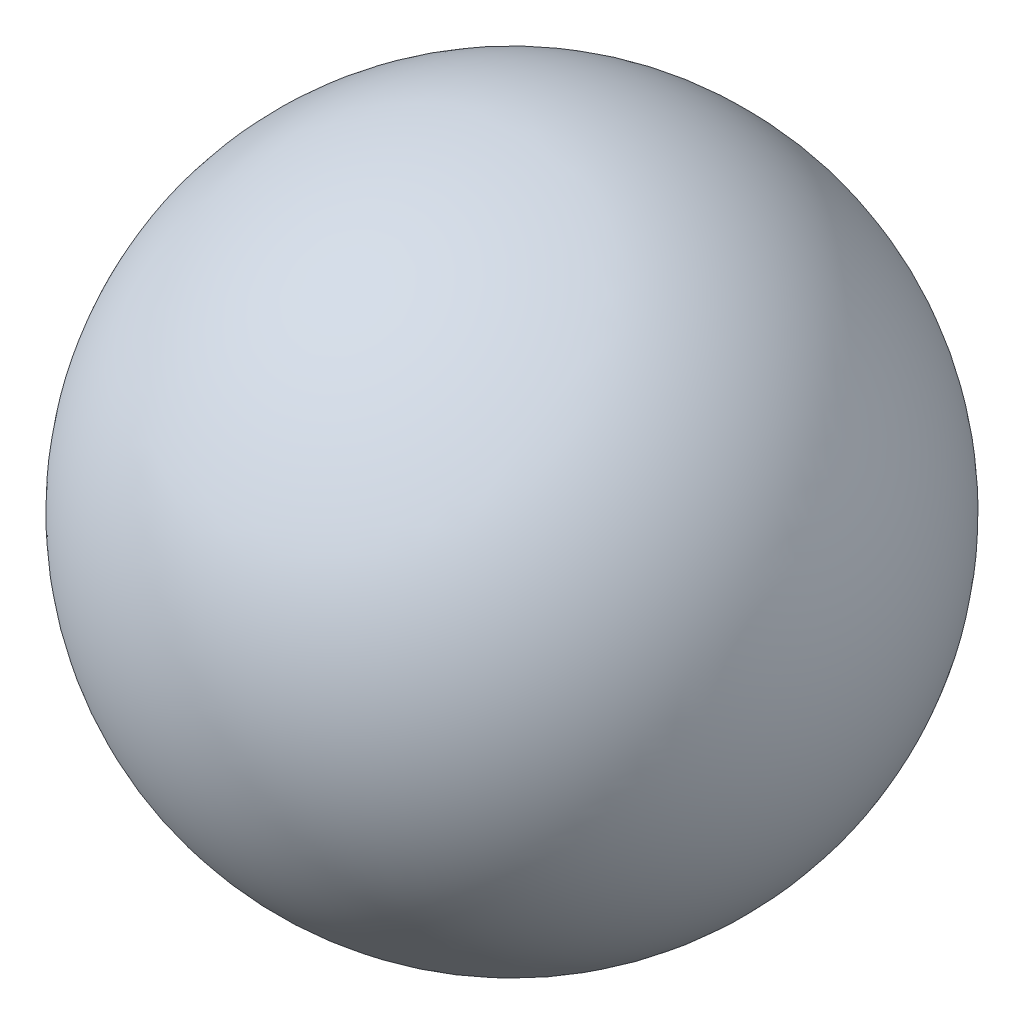
from build123d import *


with BuildPart() as part:
    # Sketch1 → Revolve1 (revolve)
    with BuildSketch(Plane.XY):
        with BuildLine():
            Line((-20.75, 0), (20.75, 0))
            ThreePointArc((20.75, 0), (0, -20.75), (-20.75, 0))
        make_face()
    revolve(axis=Axis((-20.75, 0, 0), (1, 0, 0)))


solid = part.part
